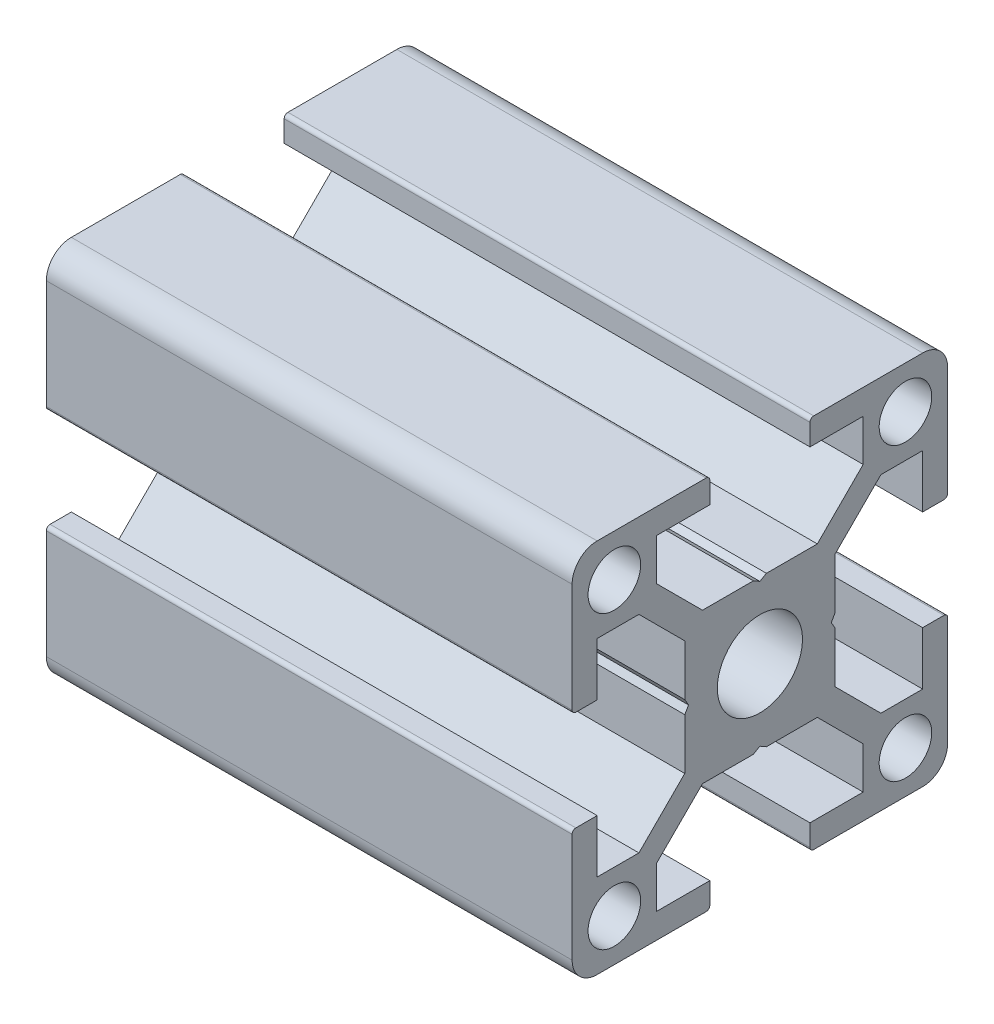
from build123d import *

# Parameters (mm, degrees)
SKETCH_1_R              = 2.1
SKETCH_1_R_2            = 3.4
F_30XS6_30X30S6_1_DEPTH = 42


with BuildPart() as part:
    # 草图1 → 30xs6 30X30S6(1) (new body)
    with BuildSketch(Plane.YZ):
        with BuildLine():
            Line((-14.7, 4), (-13, 4))
            Line((-13, 4), (-13, 8.25))
            Line((-13, 8.25), (-9.664213562, 8.25))
            Line((-9.664213562, 8.25), (-6, 4.585786438))
            Line((-6, 4.585786438), (-6, 0.519615242))
            Line((-6, 0.519615242), (-5.7, 0))
            Line((-5.7, 0), (-6, -0.519615242))
            Line((-6, -0.519615242), (-6, -4.585786438))
            Line((-6, -4.585786438), (-9.664213562, -8.25))
            Line((-9.664213562, -8.25), (-13, -8.25))
            Line((-13, -8.25), (-13, -4))
            Line((-13, -4), (-14.7, -4))
            ThreePointArc((-14.7, -4), (-14.912132034, -4.087867966), (-15, -4.3))
            Line((-15, -4.3), (-15, -13))
            ThreePointArc((-15, -13), (-14.414213562, -14.414213562), (-13, -15))
            Line((-13, -15), (-4.3, -15))
            ThreePointArc((-4.3, -15), (-4.087867966, -14.912132034), (-4, -14.7))
            Line((-4, -14.7), (-4, -13))
            Line((-4, -13), (-8.25, -13))
            Line((-8.25, -13), (-8.25, -9.664213562))
            Line((-8.25, -9.664213562), (-4.585786438, -6))
            Line((-4.585786438, -6), (-0.519615242, -6))
            Line((-0.519615242, -6), (0, -5.7))
            Line((0, -5.7), (0.519615242, -6))
            Line((0.519615242, -6), (4.585786438, -6))
            Line((4.585786438, -6), (8.25, -9.664213562))
            Line((8.25, -9.664213562), (8.25, -13))
            Line((8.25, -13), (4, -13))
            Line((4, -13), (4, -14.7))
            ThreePointArc((4, -14.7), (4.087867966, -14.912132034), (4.3, -15))
            Line((4.3, -15), (13, -15))
            ThreePointArc((13, -15), (14.414213562, -14.414213562), (15, -13))
            Line((15, -13), (15, -4.3))
            ThreePointArc((15, -4.3), (14.912132034, -4.087867966), (14.7, -4))
            Line((14.7, -4), (13, -4))
            Line((13, -4), (13, -8.25))
            Line((13, -8.25), (9.664213562, -8.25))
            Line((9.664213562, -8.25), (6, -4.585786438))
            Line((6, -4.585786438), (6, -0.519615242))
            Line((6, -0.519615242), (5.7, 0))
            Line((5.7, 0), (6, 0.519615242))
            Line((6, 0.519615242), (6, 4.585786438))
            Line((6, 4.585786438), (9.664213562, 8.25))
            Line((9.664213562, 8.25), (13, 8.25))
            Line((13, 8.25), (13, 4))
            Line((13, 4), (14.7, 4))
            ThreePointArc((14.7, 4), (14.912132034, 4.087867966), (15, 4.3))
            Line((15, 4.3), (15, 13))
            ThreePointArc((15, 13), (14.414213562, 14.414213562), (13, 15))
            Line((13, 15), (4.3, 15))
            ThreePointArc((4.3, 15), (4.087867966, 14.912132034), (4, 14.7))
            Line((4, 14.7), (4, 13))
            Line((4, 13), (8.25, 13))
            Line((8.25, 13), (8.25, 9.664213562))
            Line((8.25, 9.664213562), (4.585786438, 6))
            Line((4.585786438, 6), (0.519615242, 6))
            Line((0.519615242, 6), (0, 5.7))
            Line((0, 5.7), (-0.519615242, 6))
            Line((-0.519615242, 6), (-4.585786438, 6))
            Line((-4.585786438, 6), (-8.25, 9.664213562))
            Line((-8.25, 9.664213562), (-8.25, 13))
            Line((-8.25, 13), (-4, 13))
            Line((-4, 13), (-4, 14.7))
            ThreePointArc((-4, 14.7), (-4.087867966, 14.912132034), (-4.3, 15))
            Line((-4.3, 15), (-13, 15))
            ThreePointArc((-13, 15), (-14.414213562, 14.414213562), (-15, 13))
            Line((-15, 13), (-15, 4.3))
            ThreePointArc((-15, 4.3), (-14.912132034, 4.087867966), (-14.7, 4))
        make_face()
        with Locations((11.625, 11.625)):
            Circle(SKETCH_1_R, mode=Mode.SUBTRACT)
        with Locations((11.625, -11.625)):
            Circle(SKETCH_1_R, mode=Mode.SUBTRACT)
        Circle(SKETCH_1_R_2, mode=Mode.SUBTRACT)
        with Locations((-11.625, -11.625)):
            Circle(SKETCH_1_R, mode=Mode.SUBTRACT)
        with Locations((-11.625, 11.625)):
            Circle(SKETCH_1_R, mode=Mode.SUBTRACT)
    extrude(amount=F_30XS6_30X30S6_1_DEPTH)


solid = part.part
